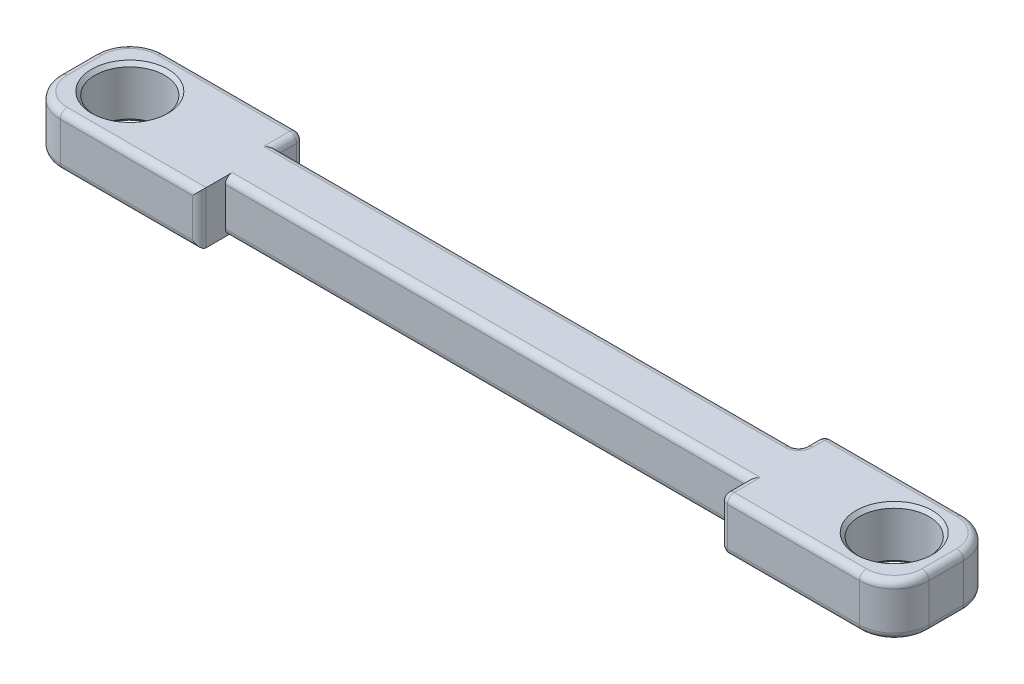
from build123d import *

# Parameters (mm, degrees)
BOSS_EXTRUDE1_DEPTH = 1.5
SKETCH2_R           = 1
CUT_EXTRUDE1_DEPTH  = 13.678722333
CHAMFER1_SIZE       = 0.1
FILLET1_R           = 0.2


with BuildPart() as part:
    # Sketch1 → Boss-Extrude1 (new body)
    with BuildSketch(Plane(origin=(0, 0, 0), x_dir=(1, 0, 0), z_dir=(0, 1, 0))):
        with BuildLine():
            Line((7.5, -0.75), (7.5, -1.5))
            Line((7.5, -1.5), (11.5, -1.5))
            ThreePointArc((11.5, -1.5), (12.207106781, -1.207106781), (12.5, -0.5))
            Line((12.5, -0.5), (12.5, 0.5))
            ThreePointArc((12.5, 0.5), (12.207106781, 1.207106781), (11.5, 1.5))
            Line((11.5, 1.5), (7.5, 1.5))
            Line((7.5, 1.5), (7.5, 0.75))
            Line((7.5, 0.75), (-7.5, 0.75))
            Line((-7.5, 0.75), (-7.5, 1.5))
            Line((-7.5, 1.5), (-11.5, 1.5))
            ThreePointArc((-11.5, 1.5), (-12.207106781, 1.207106781), (-12.5, 0.5))
            Line((-12.5, 0.5), (-12.5, -0.5))
            ThreePointArc((-12.5, -0.5), (-12.207106781, -1.207106781), (-11.5, -1.5))
            Line((-11.5, -1.5), (-7.5, -1.5))
            Line((-7.5, -1.5), (-7.5, -0.75))
            Line((-7.5, -0.75), (7.5, -0.75))
        make_face()
    extrude(amount=BOSS_EXTRUDE1_DEPTH)

    # Sketch2 → Cut-Extrude1 (cut, through all)
    with BuildSketch(Plane(origin=(0, 1.5, 0), x_dir=(1, 0, 0), z_dir=(0, 1, 0))):
        with Locations(Location((-11, 0, 0), (0, 0, 270))):
            Circle(SKETCH2_R)
        with Locations(Location((11, 0, 0), (0, 0, 270))):
            Circle(SKETCH2_R)
    extrude(amount=-CUT_EXTRUDE1_DEPTH, mode=Mode.SUBTRACT)

    # Chamfer1
    chamfer1_edges = [part.edges().sort_by_distance(p)[0] for p in [
        (-11, 0, -1),
        (-11, 1.5, -1),
        (11, 0, -1),
        (11, 1.5, -1),
    ]]
    chamfer(chamfer1_edges, length=CHAMFER1_SIZE)

    # Fillet1
    fillet1_edges = [part.edges().sort_by_distance(p)[0] for p in [
        (7.5, 0, 1.125),
        (7.5, 0, -1.125),
        (0, 0, 0.75),
        (12.5, 1.5, 0),
        (7.5, 1.5, 1.125),
        (0, 1.5, 0.75),
        (-12.5, 1.5, 0),
        (-7.5, 1.5, -1.125),
        (7.5, 1.5, -1.125),
        (-7.5, 0.75, -1.5),
        (-9.5, 1.5, -1.5),
        (-9.5, 0, -1.5),
        (7.5, 0.75, -0.75),
        (0, 1.5, -0.75),
        (0, 0, -0.75),
        (9.5, 1.5, -1.5),
        (7.5, 0.75, -1.5),
        (9.5, 0, -1.5),
        (-9.5, 1.5, 1.5),
        (-7.5, 0.75, 1.5),
        (-9.5, 0, 1.5),
        (7.5, 0.75, 1.5),
        (9.5, 1.5, 1.5),
        (9.5, 0, 1.5),
        (12.207106781, 0, -1.207106781),
        (12.5, 0, 0),
        (12.207106781, 0, 1.207106781),
        (12.207106781, 1.5, -1.207106781),
        (12.207106781, 1.5, 1.207106781),
        (-12.207106781, 0, 1.207106781),
        (-12.5, 0, 0),
        (-12.207106781, 0, -1.207106781),
        (-12.207106781, 1.5, 1.207106781),
        (-12.207106781, 1.5, -1.207106781),
    ]]
    fillet(fillet1_edges, radius=FILLET1_R)


solid = part.part
